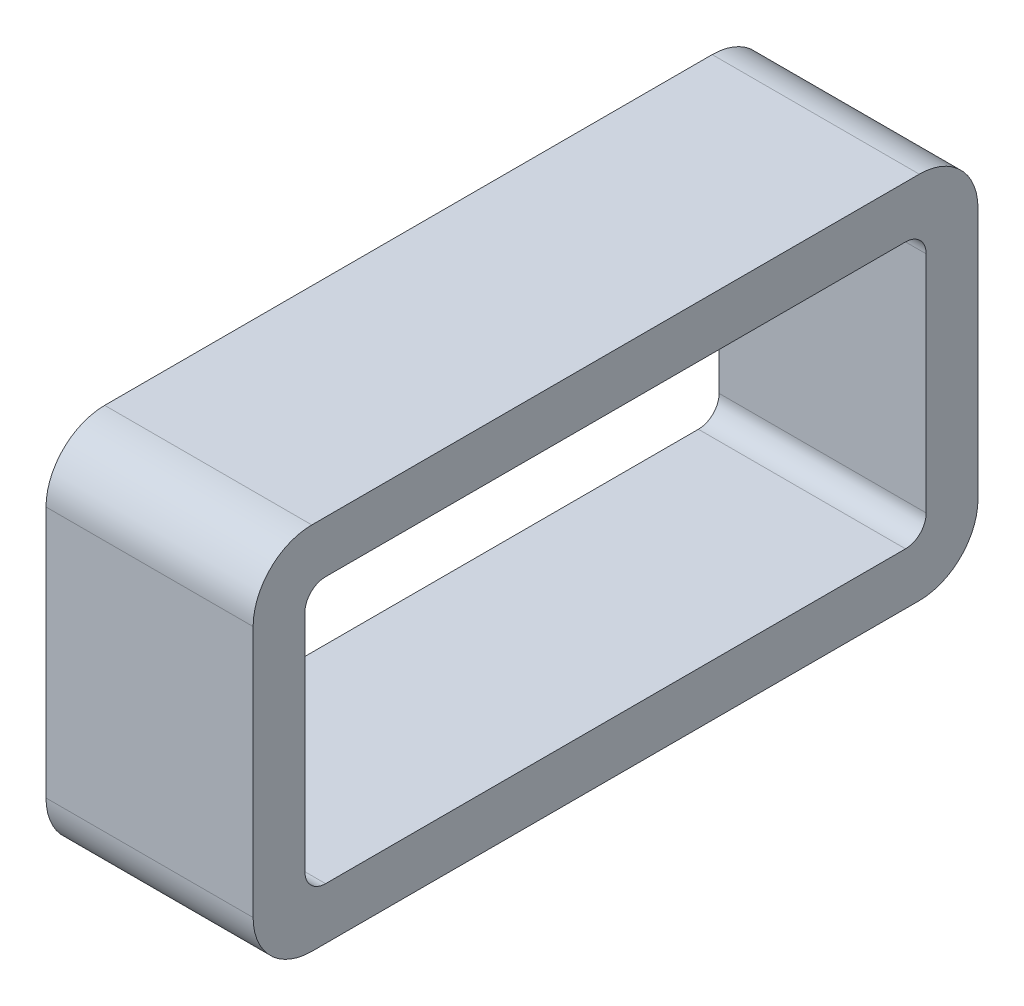
from build123d import *

# Parameters (mm, degrees)
SKETCH1_W           = 21
SKETCH1_H           = 10.7
SKETCH1_W_2         = 18
SKETCH1_H_2         = 7.7
BOSS_EXTRUDE1_DEPTH = 6
FILLET1_R           = 0.6
FILLET2_R           = 1.7


with BuildPart() as part:
    # Sketch1 → Boss-Extrude1 (new body)
    with BuildSketch(Plane(origin=(0, 0, 0), x_dir=(0, 0, -1), z_dir=(1, 0, 0))):
        Rectangle(SKETCH1_W, SKETCH1_H)
        Rectangle(SKETCH1_W_2, SKETCH1_H_2, mode=Mode.SUBTRACT)
    extrude(amount=BOSS_EXTRUDE1_DEPTH)

    # Fillet1
    fillet1_edges = [part.edges().sort_by_distance(p)[0] for p in [
        (3, -3.85, -9),
        (3, 3.85, -9),
        (3, 3.85, 9),
        (3, -3.85, 9),
    ]]
    fillet(fillet1_edges, radius=FILLET1_R)

    # Fillet2
    fillet2_edges = [part.edges().sort_by_distance(p)[0] for p in [
        (3, -5.35, -10.5),
        (3, -5.35, 10.5),
        (3, 5.35, 10.5),
        (3, 5.35, -10.5),
    ]]
    fillet(fillet2_edges, radius=FILLET2_R)


solid = part.part
